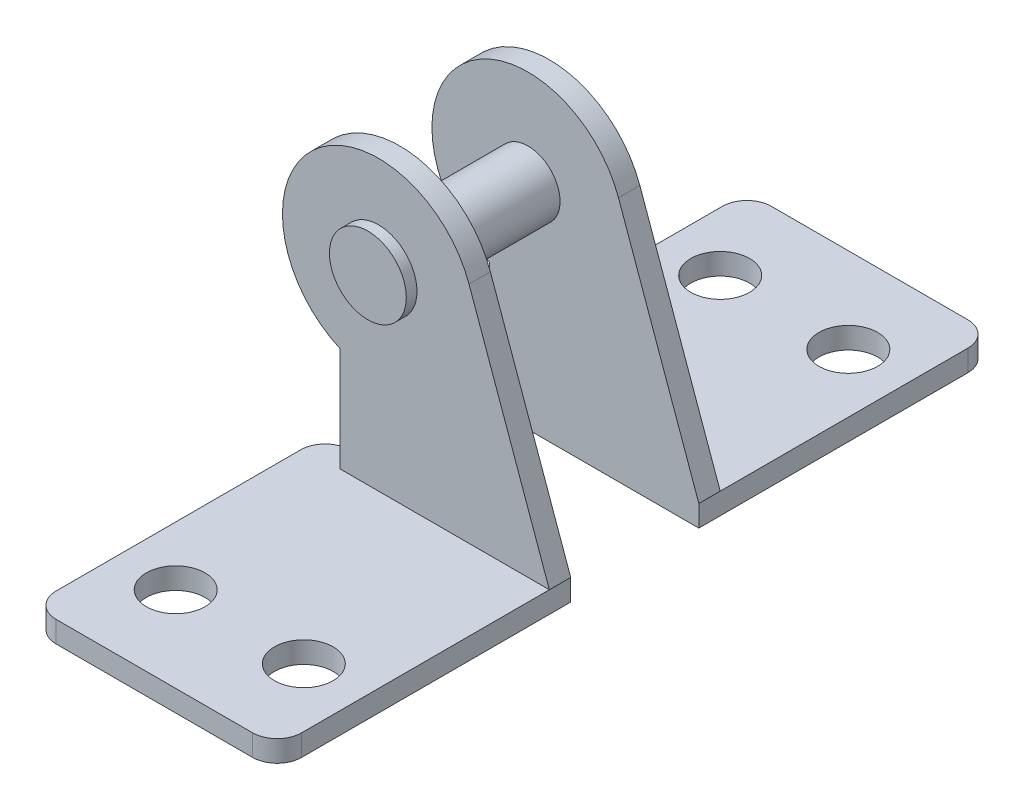
from build123d import *

# Parameters (mm, degrees)
EXTRUDE_START       = 33.5
SKETCH_3_W          = 23
SKETCH_3_H          = 2
EXTRUDE_1_DEPTH     = 67
EXTRUDE_START_2     = 8
SKETCH_4_R          = 3
EXTRUDE_2_DEPTH     = 2
EXTRUDE_START_3     = -6
SKETCH_5_R          = 3
EXTRUDE_3_DEPTH     = 2
SKETCH_6_R          = 3.6
EXTRUDE_4_DEPTH     = 1
EXTRUDE_START_4     = 16
SKETCH_7_R          = 3
EXTRUDE_5_DEPTH     = 16
SKETCH_8_W          = 12
SKETCH_8_H          = 12.516134774
CUT_EXTRUDE_1_DEPTH = 23
SKETCH_9_R          = 2.75
CUT_EXTRUDE_2_DEPTH = 46.094345544
FILLET_3_R          = 2.3


with BuildPart() as part:
    # 草图3 → 凸台-拉伸1 (new body)
    with BuildSketch(Plane.XY.offset(EXTRUDE_START)):
        with Locations((0, 1)):
            Rectangle(SKETCH_3_W, SKETCH_3_H)
    extrude(amount=-EXTRUDE_1_DEPTH)

    # 草图4 → 凸台-拉伸2 (add)
    with BuildSketch(Plane.XY.offset(EXTRUDE_START_2)):
        with BuildLine():
            Line((-8.1, 11.751363749), (-8.1, 0))
            Line((-8.1, 0), (11.5, 0))
            Line((11.5, 0), (11.5, 2))
            Line((11.5, 2), (3.973803242, 23.032269549))
            ThreePointArc((3.973803242, 23.032269549), (-10.644363142, 26.576230043), (-8.1, 11.751363749))
        make_face()
        with Locations((-4.5, 20)):
            Circle(SKETCH_4_R, mode=Mode.SUBTRACT)
    extrude(amount=-EXTRUDE_2_DEPTH)

    # 草图5 → 凸台-拉伸3 (add)
    with BuildSketch(Plane.XY.offset(EXTRUDE_START_3)):
        with BuildLine():
            Line((-8.1, 11.751363749), (-8.1, 0))
            Line((-8.1, 0), (11.5, 0))
            Line((11.5, 0), (11.5, 2))
            Line((11.5, 2), (3.973803242, 23.032269549))
            ThreePointArc((3.973803242, 23.032269549), (-10.644363142, 26.576230043), (-8.1, 11.751363749))
        make_face()
        with Locations((-4.5, 20)):
            Circle(SKETCH_5_R, mode=Mode.SUBTRACT)
    extrude(amount=-EXTRUDE_3_DEPTH)

    # 草图6 → 凸台-拉伸4 (add)
    with BuildSketch(Plane.XY.offset(8)):
        with Locations((-4.5, 20)):
            Circle(SKETCH_6_R)
    extrude_4 = extrude(amount=EXTRUDE_4_DEPTH)

    # 镜向2: 凸台-拉伸4 across plane
    add(extrude_4.mirror(Plane.XY))

    # 草图7 → 凸台-拉伸5 (add)
    with BuildSketch(Plane.XY.offset(-8).offset(EXTRUDE_START_4)):
        with Locations((-4.5, 20)):
            Circle(SKETCH_7_R)
    extrude(amount=-EXTRUDE_5_DEPTH)

    # 草图8 → 切除-拉伸1 (cut)
    with BuildSketch(Plane(origin=(11.5, 0, 0), x_dir=(0, 0, -1), z_dir=(1, 0, 0))):
        with Locations((0, 6.258067387)):
            Rectangle(SKETCH_8_W, SKETCH_8_H)
    extrude(amount=-CUT_EXTRUDE_1_DEPTH, mode=Mode.SUBTRACT)

    # 草图9 → 切除-拉伸2 (cut, through all)
    with BuildSketch(Plane(origin=(0, 2, 0), x_dir=(1, 0, 0), z_dir=(0, 1, 0))):
        with Locations(Location((-6, 25.5, 0), (0, 0, 270))):
            Circle(SKETCH_9_R)
        with Locations(Location((6, 25.5, 0), (0, 0, 90))):
            Circle(SKETCH_9_R)
        with Locations(Location((6, -25.5, 0), (0, 0, 270))):
            Circle(SKETCH_9_R)
        with Locations(Location((-6, -25.5, 0), (0, 0, 90))):
            Circle(SKETCH_9_R)
    extrude(amount=-CUT_EXTRUDE_2_DEPTH, mode=Mode.SUBTRACT)

    # 圆角3
    fillet_3_edges = [part.edges().sort_by_distance(p)[0] for p in [
        (-11.5, 1, -33.5),
        (-11.5, 1, 33.5),
        (11.5, 1, 33.5),
        (11.5, 1, -33.5),
        (-11.5, 1, -6),
        (-11.5, 1, 6),
    ]]
    fillet(fillet_3_edges, radius=FILLET_3_R)


solid = part.part
